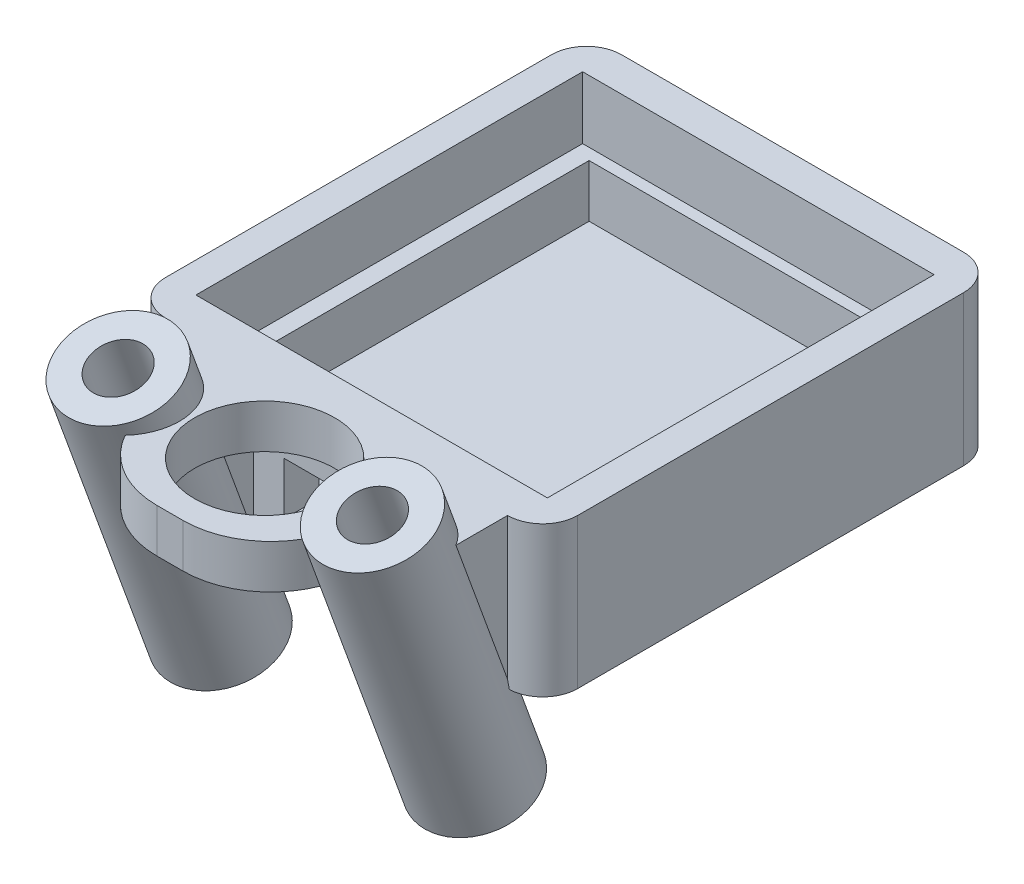
from build123d import *

# Parameters (mm, degrees)
BOSS_EXTRUDE1_DEPTH       = 8.55
SKETCH1_4_W               = 18
SKETCH1_4_H               = 23.4
BOSS_EXTRUDE2_DEPTH       = 2
SKETCH2_W                 = 20.04
SKETCH2_H                 = 24.05
CUT_EXTRUDE1_DEPTH        = 3.55
SKETCH3_W                 = 6
SKETCH3_H                 = 3
BOSS_EXTRUDE4_DEPTH       = 2
FILLET1_R                 = 2
BOSS_EXTRUDE5_DEPTH       = 23.5
SKETCH6_W                 = 2
SKETCH6_H                 = 3.111945503
SKETCH6_W_2               = 9.5
CUT_EXTRUDE2_DEPTH        = 23
SKETCH7_W                 = 5
SKETCH7_H                 = 1.291023664
BOSS_EXTRUDE6_DEPTH       = 1
BOSS_EXTRUDE11_DEPTH      = 2
BOSS_EXTRUDE11_DEPTH_BACK = 15
SKETCH8_R                 = 3
CUT_EXTRUDE3_DEPTH        = 2
CUT_EXTRUDE3_DEPTH_BACK   = 15
SKETCH8_5_R               = 1.5
SKETCH10_R                = 4
BOSS_EXTRUDE13_DEPTH      = 2.5


with BuildPart() as part:
    # Sketch1 → Boss-Extrude1 (new body)
    with BuildSketch(Plane(origin=(0, 0, 0), x_dir=(1, 0, 0), z_dir=(0, 1, 0))):
        Polygon((-11.75, 13), (-11.75, -13), (-9, -13), (-9, 10.4), (9, 10.4), (9, -13), (11.75, -13), (11.75, 13), align=None)
    extrude(amount=BOSS_EXTRUDE1_DEPTH)

    # Sketch1<4> → Boss-Extrude2 (add)
    with BuildSketch(Plane(origin=(0, 0, 0), x_dir=(1, 0, 0), z_dir=(0, 1, 0))):
        with Locations((0, -1.3)):
            Rectangle(SKETCH1_4_W, SKETCH1_4_H)
    extrude(amount=BOSS_EXTRUDE2_DEPTH)

    # Sketch2 → Cut-Extrude1 (cut)
    with BuildSketch(Plane(origin=(0, 8.55, 0), x_dir=(1, 0, 0), z_dir=(0, 1, 0))):
        with Locations((0, -0.975)):
            Rectangle(SKETCH2_W, SKETCH2_H)
    extrude(amount=-CUT_EXTRUDE1_DEPTH, mode=Mode.SUBTRACT)

    # Sketch3 → Boss-Extrude4 (add)
    with BuildSketch(Plane.XY.offset(13)):
        Polygon((-11.75, 8.55), (-3, 8.55), (3, 8.55), (11.75, 8.55), (11.75, 0), (3, 0), (-3, 0), (-11.75, 0), align=None)
        with Locations((0, 3.5)):
            Rectangle(SKETCH3_W, SKETCH3_H, mode=Mode.SUBTRACT)
    extrude(amount=-BOSS_EXTRUDE4_DEPTH)

    # Fillet1
    fillet1_edges = [part.edges().sort_by_distance(p)[0] for p in [
        (11.75, 4.275, 13),
        (11.75, 4.275, -13),
        (-11.75, 4.275, -13),
        (-11.75, 4.275, 13),
    ]]
    fillet(fillet1_edges, radius=FILLET1_R)

    # Sketch5 → Boss-Extrude5 (add)
    with BuildSketch(Plane(origin=(11.75, 0, 0), x_dir=(0, 0, -1), z_dir=(1, 0, 0))):
        Polygon((-13, 0), (-16.111945503, 8.55), (-13, 8.55), align=None)
    extrude(amount=-BOSS_EXTRUDE5_DEPTH)

    # Sketch6 → Cut-Extrude2 (cut)
    with BuildSketch(Plane(origin=(0, 8.55, 0), x_dir=(1, 0, 0), z_dir=(0, 1, 0))):
        with Locations((-10.75, -14.555972752)):
            Rectangle(SKETCH6_W, SKETCH6_H)
        with Locations((10.75, -14.555972752)):
            Rectangle(SKETCH6_W, SKETCH6_H)
        with Locations((0, -14.555972752)):
            Rectangle(SKETCH6_W_2, SKETCH6_H)
    extrude(amount=-CUT_EXTRUDE2_DEPTH, mode=Mode.SUBTRACT)

    # Sketch7 → Boss-Extrude6 (add)
    with BuildSketch(Plane(origin=(0, -4.178119463, 11.47928888), x_dir=(1, 0, 0), z_dir=(0, -0.34202014332566966, 0.939692620785908))):
        with Locations((7.25, 12.899469986)):
            Rectangle(SKETCH7_W, SKETCH7_H)
    extrude(amount=BOSS_EXTRUDE6_DEPTH)

    # Sketch8 → Boss-Extrude11 (add, two sides: drawn at the far end of the back side and taken through both)
    with BuildSketch(Plane(origin=(0, 12.728119463, 4.632656623), x_dir=(1, 0, 0), z_dir=(0, 0.939692620785908, 0.3420201433256697)).offset(-BOSS_EXTRUDE11_DEPTH_BACK)):
        with Locations((7.25, -13.71600407)):
            Circle(SKETCH8_R)
        with Locations((-7.25, -13.71600407)):
            Circle(SKETCH8_R)
    extrude(amount=BOSS_EXTRUDE11_DEPTH + BOSS_EXTRUDE11_DEPTH_BACK)

    # Sketch8<5> → Cut-Extrude3 (cut, two sides: drawn at the far end of the back side and taken through both)
    with BuildSketch(Plane(origin=(0, 12.728119463, 4.632656623), x_dir=(1, 0, 0), z_dir=(0, 0.939692620785908, 0.3420201433256697)).offset(-CUT_EXTRUDE3_DEPTH_BACK)):
        with Locations((-7.25, -13.71600407)):
            Circle(SKETCH8_5_R)
        with Locations((7.25, -13.71600407)):
            Circle(SKETCH8_5_R)
    extrude(amount=CUT_EXTRUDE3_DEPTH + CUT_EXTRUDE3_DEPTH_BACK, mode=Mode.SUBTRACT)

    # Sketch10 → Boss-Extrude13 (add)
    with BuildSketch(Plane(origin=(0, 8.55, 0), x_dir=(1, 0, 0), z_dir=(0, 1, 0))):
        with BuildLine():
            Line((-5.75, -11), (5.75, -11))
            Line((5.75, -11), (5.75, -17.5))
            ThreePointArc((5.75, -17.5), (4.285533906, -21.035533906), (0.75, -22.5))
            Line((0.75, -22.5), (-0.75, -22.5))
            ThreePointArc((-0.75, -22.5), (-4.285533906, -21.035533906), (-5.75, -17.5))
            Line((-5.75, -17.5), (-5.75, -11))
        make_face()
        with Locations((0, -17.1)):
            Circle(SKETCH10_R, mode=Mode.SUBTRACT)
    extrude(amount=-BOSS_EXTRUDE13_DEPTH)


solid = part.part
